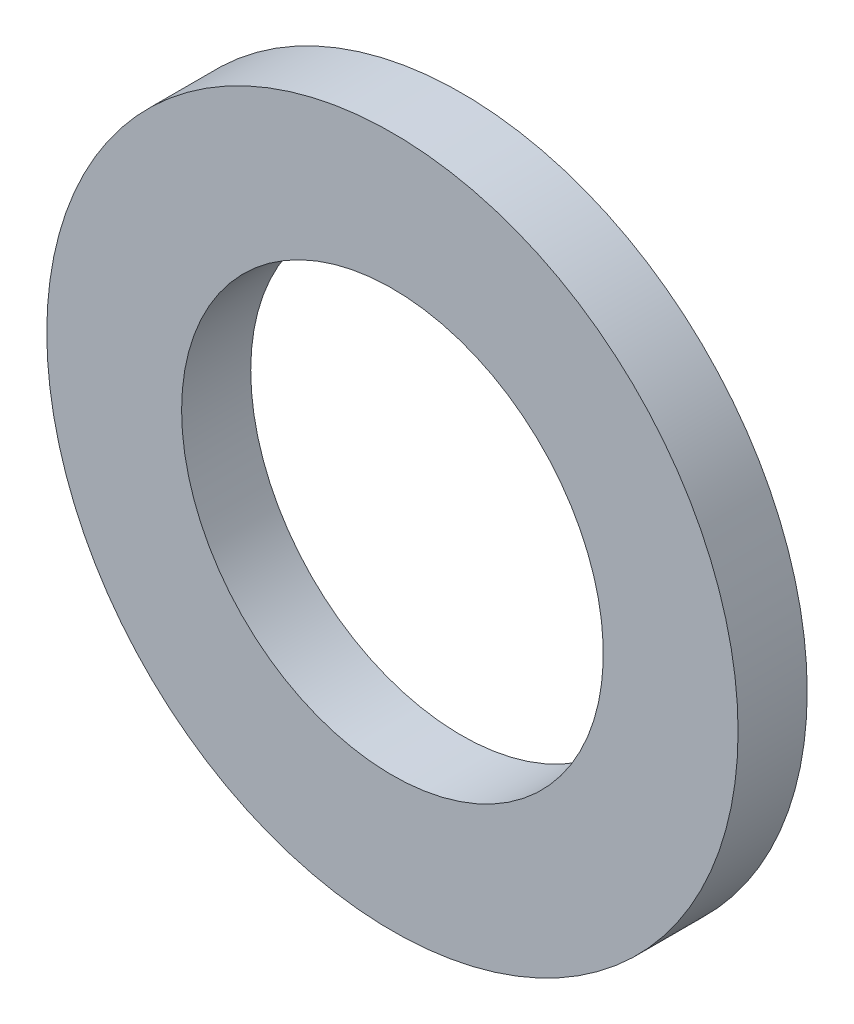
from build123d import *

# Parameters (mm, degrees)
SKETCH1_W = 0.975
SKETCH1_H = 0.5


with BuildPart() as part:
    # Sketch1 → Revolve1 (revolve)
    with BuildSketch(Plane.XZ, mode=Mode.PRIVATE) as revolve1_sk:
        with Locations((2.0125, 0)):
            Rectangle(SKETCH1_W, SKETCH1_H)
    revolve(revolve1_sk.sketch.rotate(Axis((0, 0, 0.25), (0, 0, -1)), 180), axis=Axis((0, 0, 0.25), (0, 0, -1)))


solid = part.part
